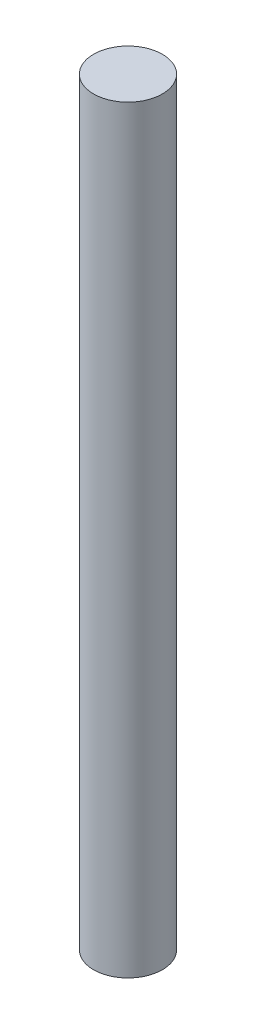
from build123d import *

# Parameters (mm, degrees)
SKETCH1_R           = 3.175
BOSS_EXTRUDE1_DEPTH = 70


with BuildPart() as part:
    # Sketch1 → Boss-Extrude1 (new body)
    with BuildSketch(Plane(origin=(0, 0, 0), x_dir=(1, 0, 0), z_dir=(0, 1, 0))):
        with Locations(Location((0, 0, 0), (0, 0, 270))):
            Circle(SKETCH1_R)
    extrude(amount=BOSS_EXTRUDE1_DEPTH)


solid = part.part
